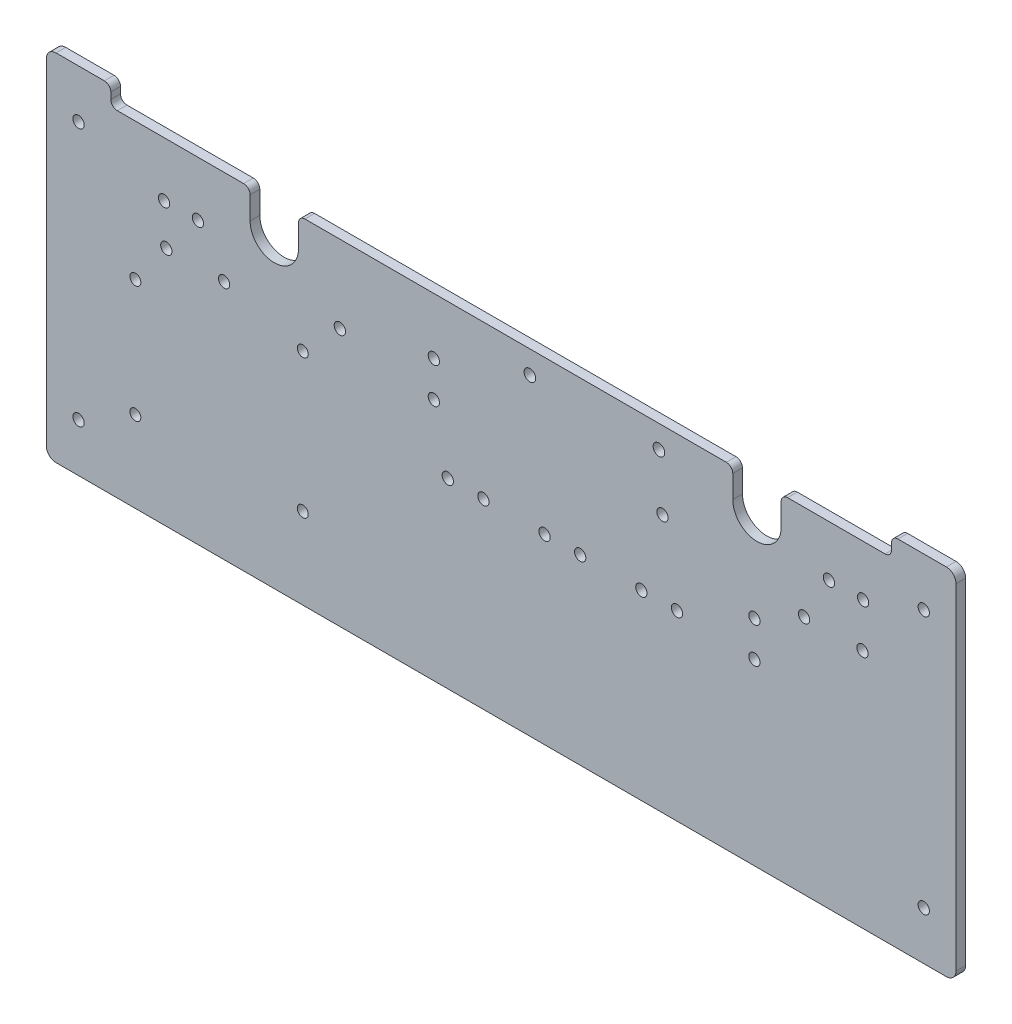
from build123d import *

# Parameters (mm, degrees)
SKETCH1_R           = 1.75
SKETCH1_R_2         = 1.8
SKETCH1_R_3         = 1.7
BOSS_EXTRUDE1_DEPTH = 3


with BuildPart() as part:
    # Sketch1 → Boss-Extrude1 (new body)
    with BuildSketch(Plane.XY):
        with BuildLine():
            Line((-138, 334), (-123.000000001, 334))
            ThreePointArc((-123.000000001, 334), (-121.585786438, 333.414213562), (-121.000000001, 332))
            Line((-121.000000001, 332), (-121.000000001, 330))
            ThreePointArc((-121.000000001, 330), (-120.414213563, 328.585786438), (-119.000000001, 328))
            Line((-119.000000001, 328), (-79.825853915, 328))
            ThreePointArc((-79.825853915, 328), (-78.411640352, 327.414213562), (-77.825853915, 326))
            Line((-77.825853915, 326), (-77.825853915, 319))
            ThreePointArc((-77.825853915, 319), (-70.325853915, 311.5), (-62.825853915, 319))
            Line((-62.825853915, 319), (-62.825853915, 326))
            ThreePointArc((-62.825853915, 326), (-62.240067477, 327.414213562), (-60.825853915, 328))
            Line((-60.825853915, 328), (69.799384712, 328))
            ThreePointArc((69.799384712, 328), (71.213598275, 327.414213562), (71.799384712, 326))
            Line((71.799384712, 326), (71.799384712, 319))
            ThreePointArc((71.799384712, 319), (79.299384712, 311.5), (86.799384712, 319))
            Line((86.799384712, 319), (86.799384712, 326))
            ThreePointArc((86.799384712, 326), (87.38517115, 327.414213562), (88.799384712, 328))
            Line((88.799384712, 328), (119.000000001, 328))
            ThreePointArc((119.000000001, 328), (120.414213563, 328.585786438), (121.000000001, 330))
            Line((121.000000001, 330), (121.000000001, 332))
            ThreePointArc((121.000000001, 332), (121.585786438, 333.414213562), (123.000000001, 334))
            Line((123.000000001, 334), (138, 334))
            ThreePointArc((138, 334), (140.121320344, 333.121320344), (141, 331))
            Line((141, 331), (141, 227))
            ThreePointArc((141, 227), (140.121320344, 224.878679656), (138, 224))
            Line((138, 224), (-138, 224))
            ThreePointArc((-138, 224), (-140.121320344, 224.878679656), (-141, 227))
            Line((-141, 227), (-141, 331))
            ThreePointArc((-141, 331), (-140.121320344, 333.121320344), (-138, 334))
        make_face()
        with Locations((-131, 319)):
            Circle(SKETCH1_R, mode=Mode.SUBTRACT)
        with Locations((-131, 239)):
            Circle(SKETCH1_R, mode=Mode.SUBTRACT)
        with Locations((131, 319)):
            Circle(SKETCH1_R, mode=Mode.SUBTRACT)
        with Locations((131, 239)):
            Circle(SKETCH1_R, mode=Mode.SUBTRACT)
        with Locations((-104.5, 311.05)):
            Circle(SKETCH1_R, mode=Mode.SUBTRACT)
        with Locations((-94, 311.05)):
            Circle(SKETCH1_R, mode=Mode.SUBTRACT)
        with Locations((-103.8, 298.65)):
            Circle(SKETCH1_R, mode=Mode.SUBTRACT)
        with Locations((-85.9, 298.65)):
            Circle(SKETCH1_R, mode=Mode.SUBTRACT)
        with Locations((101.6, 312.25)):
            Circle(SKETCH1_R, mode=Mode.SUBTRACT)
        with Locations((112.2, 312.25)):
            Circle(SKETCH1_R, mode=Mode.SUBTRACT)
        with Locations((93.9, 298.55)):
            Circle(SKETCH1_R, mode=Mode.SUBTRACT)
        with Locations((112, 298.55)):
            Circle(SKETCH1_R, mode=Mode.SUBTRACT)
        with Locations((-50, 304)):
            Circle(SKETCH1_R, mode=Mode.SUBTRACT)
        with Locations((50, 304)):
            Circle(SKETCH1_R, mode=Mode.SUBTRACT)
        with Locations((8.910068617, 320.939971353)):
            Circle(SKETCH1_R_2, mode=Mode.SUBTRACT)
        with Locations((48.910068617, 320.939971353)):
            Circle(SKETCH1_R_2, mode=Mode.SUBTRACT)
        with Locations((-113.4, 285.5)):
            Circle(SKETCH1_R_3, mode=Mode.SUBTRACT)
        with Locations((-16.54, 280.5)):
            Circle(SKETCH1_R, mode=Mode.SUBTRACT)
        with Locations((-5.5, 280.5)):
            Circle(SKETCH1_R, mode=Mode.SUBTRACT)
        with Locations((13.46, 280.5)):
            Circle(SKETCH1_R, mode=Mode.SUBTRACT)
        with Locations((-113.4, 249.2)):
            Circle(SKETCH1_R_3, mode=Mode.SUBTRACT)
        with Locations((-61.5, 249.2)):
            Circle(SKETCH1_R_3, mode=Mode.SUBTRACT)
        with Locations((-61.5, 292.2)):
            Circle(SKETCH1_R_3, mode=Mode.SUBTRACT)
        with Locations((24.5, 280.5)):
            Circle(SKETCH1_R, mode=Mode.SUBTRACT)
        with Locations((43.46, 280.5)):
            Circle(SKETCH1_R, mode=Mode.SUBTRACT)
        with Locations((54.5, 280.5)):
            Circle(SKETCH1_R, mode=Mode.SUBTRACT)
        with Locations((-20.870942191, 310.54)):
            Circle(SKETCH1_R, mode=Mode.SUBTRACT)
        with Locations((-20.870942191, 299.5)):
            Circle(SKETCH1_R, mode=Mode.SUBTRACT)
        with Locations((78.5, 290.5)):
            Circle(SKETCH1_R, mode=Mode.SUBTRACT)
        with Locations((78.5, 279.46)):
            Circle(SKETCH1_R, mode=Mode.SUBTRACT)
    extrude(amount=BOSS_EXTRUDE1_DEPTH)


solid = part.part
